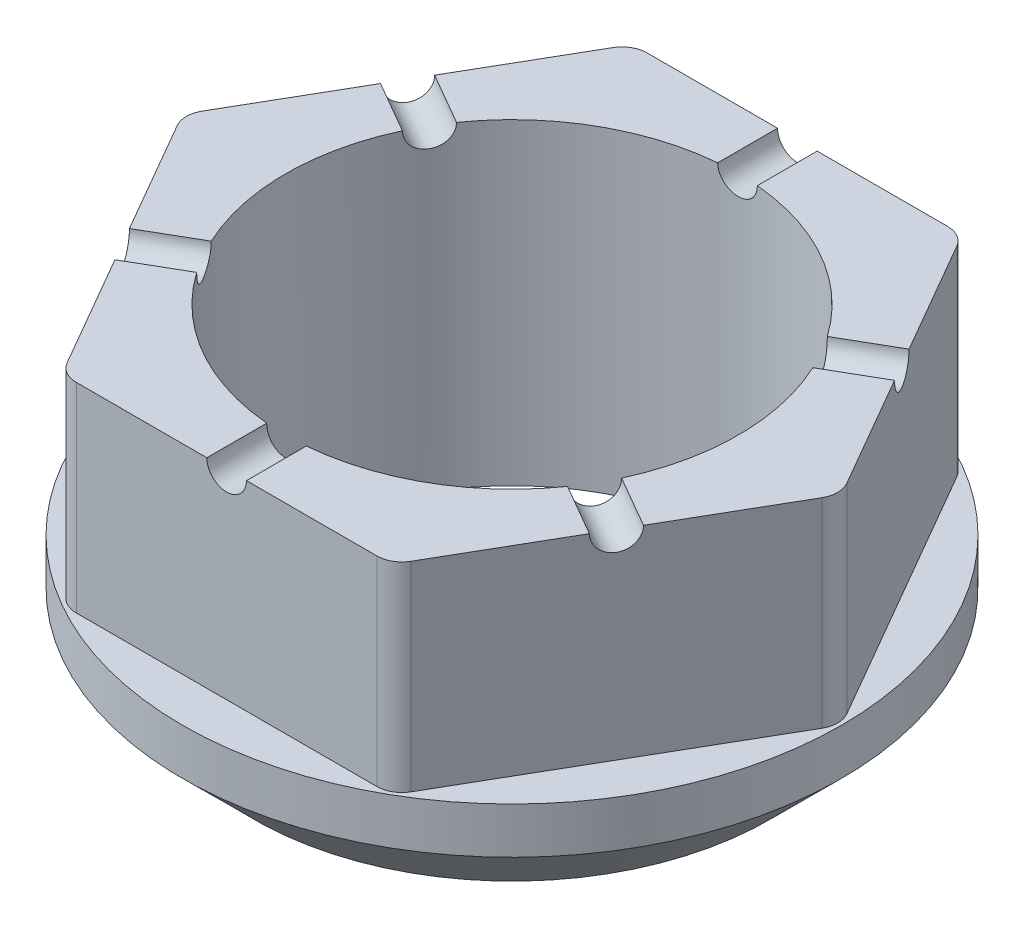
from build123d import *

# Parameters (mm, degrees)
CUT_EXTRUDE5_START = -20
CUT_EXTRUDE5_DEPTH = 20
FILLET4_R          = 2.5
CUT_EXTRUDE6_START = -86.02405492
SKETCH7_R          = 1.984375
CUT_EXTRUDE6_DEPTH = 143.469271841
CIRPATTERN2_COUNT  = 6


with BuildPart() as part:
    # Sketch1 → Revolve1 (revolve)
    with BuildSketch(Plane(origin=(0, 0, 0), x_dir=(0, 0, -1), z_dir=(1, 0, 0)), mode=Mode.PRIVATE) as revolve1_sk:
        Polygon((-22.6695, -31.75), (-22.6695, 0), (-33, 0), (-33, -24.619433914), (-25.8445, -31.75), align=None)
    revolve(revolve1_sk.sketch.rotate(Axis((0, 0, 0), (0, 1, 0)), 180), axis=Axis((0, 0, 0), (0, 1, 0)))

    # Sketch4 → Cut-Extrude5 (cut)
    with BuildSketch(Plane(origin=(0, 0, 0), x_dir=(1, 0, 0), z_dir=(0, 1, 0)).offset(CUT_EXTRUDE5_START)):
        with BuildLine():
            ThreePointArc((33, 0), (28.578838325, 16.5), (16.5, 28.578838325))
            Line((16.5, 28.578838325), (33, 0))
        make_face()
        with BuildLine():
            Line((-16.5, 28.578838325), (16.5, 28.578838325))
            ThreePointArc((16.5, 28.578838325), (0, 33), (-16.5, 28.578838325))
        make_face()
        with BuildLine():
            Line((-33, 0), (-16.5, 28.578838325))
            ThreePointArc((-16.5, 28.578838325), (-28.578838325, 16.5), (-33, 0))
        make_face()
        with BuildLine():
            ThreePointArc((16.5, -28.578838325), (28.578838325, -16.5), (33, 0))
            Line((33, 0), (16.5, -28.578838325))
        make_face()
        with BuildLine():
            Line((-16.5, -28.578838325), (-33, 0))
            ThreePointArc((-33, 0), (-28.578838325, -16.5), (-16.5, -28.578838325))
        make_face()
        with BuildLine():
            ThreePointArc((-16.5, -28.578838325), (0, -33), (16.5, -28.578838325))
            Line((16.5, -28.578838325), (-16.5, -28.578838325))
        make_face()
    extrude(amount=CUT_EXTRUDE5_DEPTH, mode=Mode.SUBTRACT)

    # Fillet4
    fillet4_edges = [part.edges().sort_by_distance(p)[0] for p in [
        (33, -10, 0),
        (16.5, -10, -28.578838325),
        (-33, -10, 0),
        (16.5, -10, 28.578838325),
        (-16.5, -10, -28.578838325),
        (-16.5, -10, 28.578838325),
    ]]
    fillet(fillet4_edges, radius=FILLET4_R)

    # Sketch7 → Cut-Extrude6 (cut)
    with BuildSketch(Plane.XY.offset(CUT_EXTRUDE6_START)):
        Circle(SKETCH7_R)
    cut_extrude6 = extrude(amount=CUT_EXTRUDE6_DEPTH, mode=Mode.SUBTRACT)

    # CirPattern2: Cut-Extrude6 ×6 about axis
    cirpattern2_axis = Axis((0, 0, 0), (0, -1, 0))
    for i in range(1, CIRPATTERN2_COUNT):
        add(cut_extrude6.rotate(cirpattern2_axis, i * 360 / CIRPATTERN2_COUNT), mode=Mode.SUBTRACT)


solid = part.part
